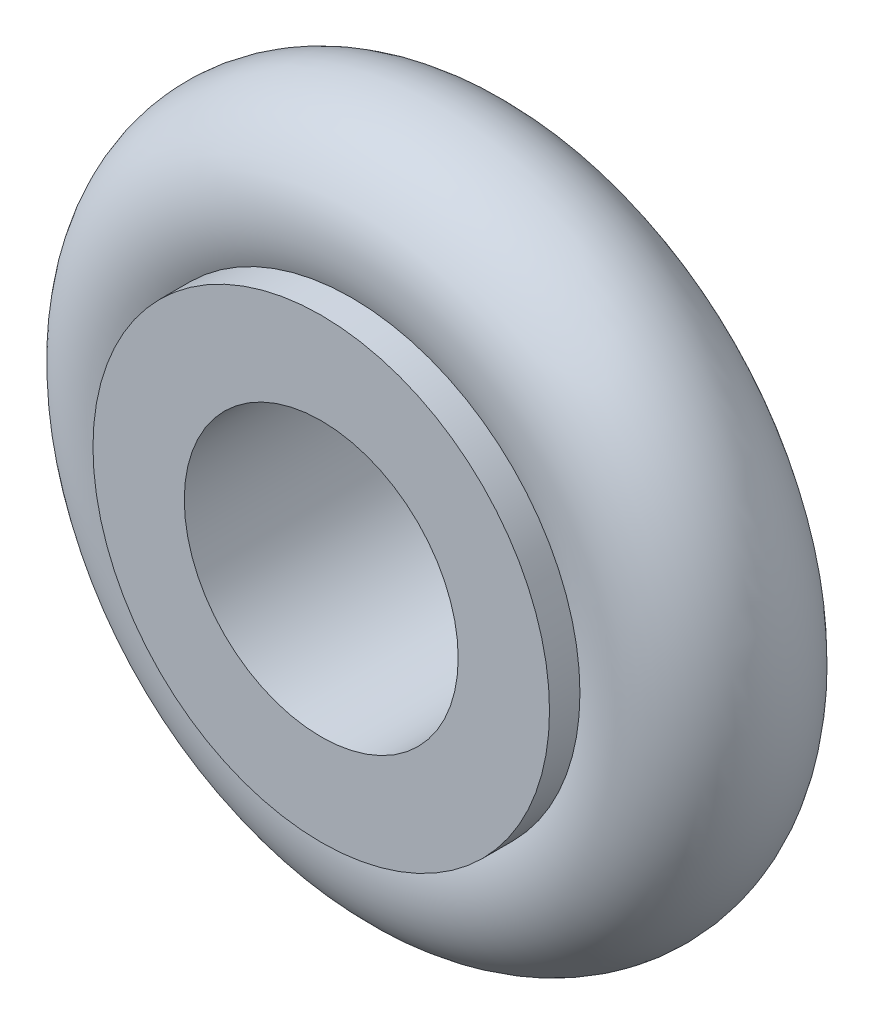
from build123d import *

# Parameters (mm, degrees)
CROQUIS5_R            = 1.5
CROQUIS6_R            = 2.25
CORTAR_EXTRUIR3_DEPTH = 3.8


with BuildPart() as part:
    # Croquis1 → Revolución1 (revolve)
    with BuildSketch(Plane(origin=(0, 0, 0), x_dir=(0, 0, -1), z_dir=(1, 0, 0)), mode=Mode.PRIVATE) as revoluci_n1_sk:
        Polygon((-1.9, 0), (-1.9, 3.75), (-1.4, 3.75), (-1.05, 2.777837601), (1.05, 2.777837601), (1.4, 3.75), (1.9, 3.75), (1.9, 0), align=None)
    revolve(revoluci_n1_sk.sketch.rotate(Axis((0, 0, -6.227056579), (0, 0, 1)), 90), axis=Axis((0, 0, -6.227056579), (0, 0, 1)))

    # Croquis6 → Cortar-Extruir3 (cut)
    with BuildSketch(Plane.XY.offset(1.9)):
        Circle(CROQUIS6_R)
    extrude(amount=-CORTAR_EXTRUIR3_DEPTH, mode=Mode.SUBTRACT)


with BuildPart() as body_2:
    # Croquis5 → Revolución2 (revolve)
    with BuildSketch(Plane(origin=(0, 0, 0), x_dir=(0, 0, -1), z_dir=(1, 0, 0)), mode=Mode.PRIVATE) as revoluci_n2_sk:
        with Locations((0, 4.289552594)):
            Circle(CROQUIS5_R)
    revolve(revoluci_n2_sk.sketch.rotate(Axis((0, 0, 9.093206655), (0, 0, -1)), 90), axis=Axis((0, 0, 9.093206655), (0, 0, -1)))


solid = Compound([part.part, body_2.part])
